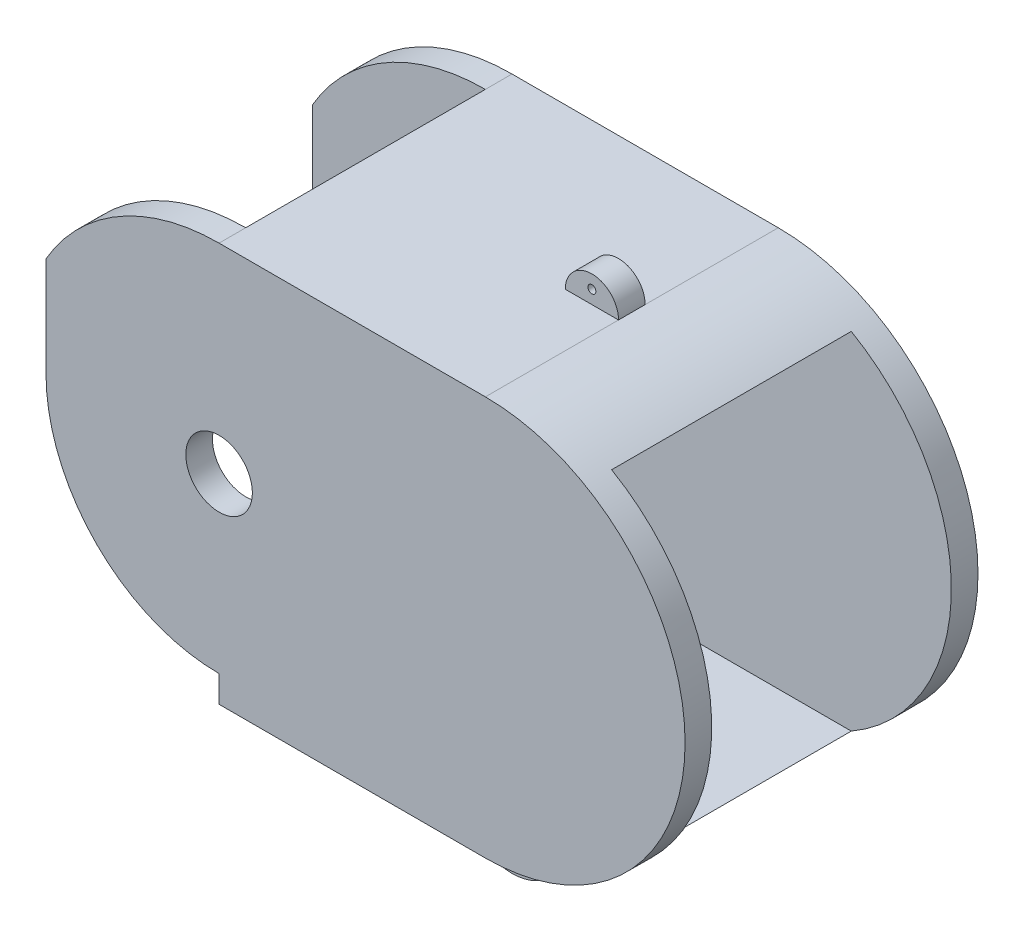
from build123d import *

# Parameters (mm, degrees)
SKETCH1_W           = 31.75
SKETCH1_H           = 19.05
BOSS_EXTRUDE1_DEPTH = 19.05
SKETCH2_R           = 1.5875
CUT_EXTRUDE2_DEPTH  = 19.05
SKETCH3_W           = 31.75
SKETCH3_H           = 2.54
SKETCH3_W_2         = 9.525
SKETCH3_H_2         = 11.43
CUT_EXTRUDE3_DEPTH  = 19.05
SKETCH4_W           = 11.43
SKETCH4_H           = 16.51
CUT_EXTRUDE4_DEPTH  = 50.8
CUT_EXTRUDE5_DEPTH  = 19.05
SKETCH6_W           = 5.08
SKETCH6_H           = 3.81
BOSS_EXTRUDE2_DEPTH = 7.62
CUT_EXTRUDE6_DEPTH  = 19.05
SKETCH8_W           = 2.54
SKETCH8_H           = 1.27
BOSS_EXTRUDE3_DEPTH = 1.27
SKETCH9_R           = 0.1905
CUT_EXTRUDE7_DEPTH  = 19.05


with BuildPart() as part:
    # Sketch1 → Boss-Extrude1 (new body)
    with BuildSketch(Plane(origin=(0, 0, 0), x_dir=(1, 0, 0), z_dir=(0, 1, 0))):
        Rectangle(SKETCH1_W, SKETCH1_H)
    extrude(amount=BOSS_EXTRUDE1_DEPTH)

    # Sketch2 → Cut-Extrude2 (cut)
    with BuildSketch(Plane.XY.offset(9.525)):
        with Locations((-6.35, 9.525)):
            Circle(SKETCH2_R)
        with BuildLine():
            ThreePointArc((-6.35, 19.05), (-15.875, 9.525), (-6.35, 0))
            ThreePointArc((-6.35, 0), (-27.315146333, 9.525), (-6.35, 19.05))
        make_face()
        with BuildLine():
            ThreePointArc((6.35, 0), (15.875, 9.525), (6.35, 19.05))
            ThreePointArc((6.35, 19.05), (24.948138119, 9.525), (6.35, 0))
        make_face()
    extrude(amount=-CUT_EXTRUDE2_DEPTH, mode=Mode.SUBTRACT)

    # Sketch3 → Cut-Extrude3 (cut)
    with BuildSketch(Plane(origin=(0, 19.05, 0), x_dir=(1, 0, 0), z_dir=(0, 1, 0))):
        with Locations((0, 8.255)):
            Rectangle(SKETCH3_W, SKETCH3_H)
        with Locations((0, -8.255)):
            Rectangle(SKETCH3_W, SKETCH3_H)
        with Locations((-11.1125, 0)):
            Rectangle(SKETCH3_W_2, SKETCH3_H_2)
    extrude(amount=-CUT_EXTRUDE3_DEPTH, mode=Mode.SUBTRACT)

    # Sketch4 → Cut-Extrude4 (cut)
    with BuildSketch(Plane(origin=(-15.875, 0, 0), x_dir=(0, 0, -1), z_dir=(1, 0, 0))):
        with Locations((0, 9.525)):
            Rectangle(SKETCH4_W, SKETCH4_H)
    extrude(amount=CUT_EXTRUDE4_DEPTH, mode=Mode.SUBTRACT)

    # Sketch5 → Cut-Extrude5 (cut)
    with BuildSketch(Plane.XY.offset(9.525)):
        with BuildLine():
            Line((-14.605, 17.4863926), (-18.31070608, 1.27))
            Line((-18.31070608, 1.27), (-18.31070608, 0))
            Line((-18.31070608, 0), (-6.35, 0))
            Line((-6.35, 0), (-6.35, 1.27))
            ThreePointArc((-6.35, 1.27), (-12.187166479, 3.687833521), (-14.605, 9.525))
            Line((-14.605, 9.525), (-14.605, 17.4863926))
        make_face()
    extrude(amount=-CUT_EXTRUDE5_DEPTH, mode=Mode.SUBTRACT)

    # Sketch6 → Boss-Extrude2 (add)
    with BuildSketch(Plane(origin=(0, 0, 0), x_dir=(1, 0, 0), z_dir=(0, 1, 0))):
        with Locations((2.54, 0)):
            Rectangle(SKETCH6_W, SKETCH6_H)
    extrude(amount=-BOSS_EXTRUDE2_DEPTH)

    # Sketch7 → Cut-Extrude6 (cut)
    with BuildSketch(Plane.XY.offset(9.525)):
        with BuildLine():
            Line((0, -2.54), (0, 0))
            ThreePointArc((0, 0), (2.54, -9.543763037), (5.08, 0))
            Line((5.08, 0), (2.940211157, 0))
            ThreePointArc((2.940211157, 0), (1.549192819, -1.039121584), (0.676226805, -2.54))
            ThreePointArc((0.676226805, -2.54), (1.276666453, -3.82212392), (2.54, -4.461152767))
            ThreePointArc((2.54, -4.461152767), (3.830489938, -3.856329433), (4.454963278, -2.575232796))
            ThreePointArc((4.454963278, -2.575232796), (4.237571766, -2.189951454), (3.823346179, -2.034651919))
            ThreePointArc((3.823346179, -2.034651919), (3.463036915, -1.694231845), (3.803456989, -1.333922582))
            ThreePointArc((3.803456989, -1.333922582), (4.691515307, -1.672580577), (5.08, -2.54))
            ThreePointArc((5.08, -2.54), (4.336051224, -4.336051224), (2.54, -5.08))
            ThreePointArc((2.54, -5.08), (0.743948776, -4.336051224), (0, -2.54))
        make_face()
    extrude(amount=-CUT_EXTRUDE6_DEPTH, mode=Mode.SUBTRACT)

    # Sketch8 → Boss-Extrude3 (add)
    with BuildSketch(Plane(origin=(0, 19.05, 0), x_dir=(1, 0, 0), z_dir=(0, 1, 0))):
        with Locations((5.08, 0)):
            Rectangle(SKETCH8_W, SKETCH8_H)
    extrude(amount=BOSS_EXTRUDE3_DEPTH)

    # Sketch9 → Cut-Extrude7 (cut)
    with BuildSketch(Plane.XY.offset(9.525)):
        with Locations((5.08, 19.685)):
            Circle(SKETCH9_R)
        with BuildLine():
            ThreePointArc((3.81, 19.05), (5.08, 20.32), (6.35, 19.05))
            ThreePointArc((6.35, 19.05), (5.08, 21.265981124), (3.81, 19.05))
        make_face()
    extrude(amount=-CUT_EXTRUDE7_DEPTH, mode=Mode.SUBTRACT)


solid = part.part
